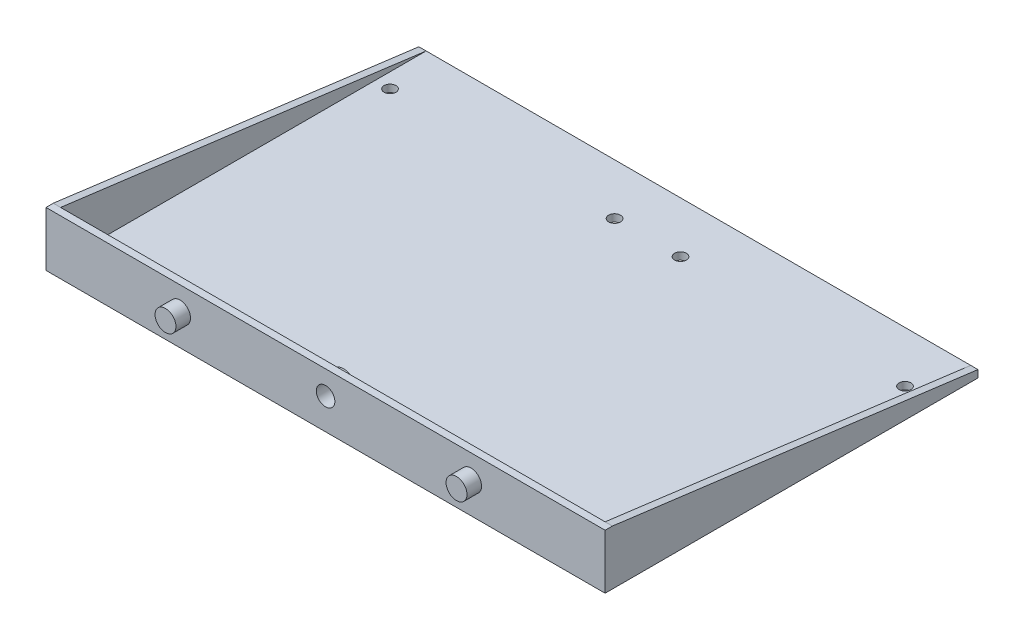
from build123d import *

# Parameters (mm, degrees)
SKETCH1_W               = 10
SKETCH1_H               = 100.5
SKETCH1_R               = 1.625
SKETCH1_W_2             = 69.85
BOSS_EXTRUDE1_DEPTH     = 2
SKETCH3_W               = 149.7
SKETCH3_H               = 2
BOSS_EXTRUDE2_DEPTH     = 2
SKETCH4_W               = 100.5
SKETCH4_H               = 2
BOSS_EXTRUDE3_DEPTH     = 2
BOSS_EXTRUDE4_DEPTH     = 2
SKETCH6_W               = 8
SKETCH6_H               = 15
BOSS_EXTRUDE5_DEPTH     = 3
CUT_EXTRUDE1_DEPTH      = 10
FILLET1_R               = 3
CUT_EXTRUDE2_DEPTH      = 10
BOSS_EXTRUDE6_START     = 3
SKETCH10_R              = 4
SKETCH10_R_2            = 2.55
BOSS_EXTRUDE6_DEPTH     = 3
SKETCH12_R              = 2.875
BOSS_EXTRUDE7_DEPTH     = 4
SKETCH13_W              = 10.946886228
SKETCH13_H              = 17.580383234
SKETCH13_W_2            = 10.296538922
SKETCH13_H_2            = 23.433508982
CUT_EXTRUDE3_DEPTH      = 43
CUT_EXTRUDE4_DEPTH      = 132
CUT_EXTRUDE4_DEPTH_BACK = 25
SKETCH15_W              = 193.54760144
SKETCH15_H              = 36.696105642


with BuildPart() as part:
    # Sketch1 → Boss-Extrude1 (new body)
    # profile 1 of 3: a face of its own
    with BuildSketch(Plane(origin=(0, 0, 0), x_dir=(1, 0, 0), z_dir=(0, 1, 0))):
        with Locations((74.85, 50.25)):
            Rectangle(SKETCH1_W, SKETCH1_H)
    # profile 2 of 3: a face of its own
    with BuildSketch(Plane(origin=(0, 0, 0), x_dir=(1, 0, 0), z_dir=(0, 1, 0))):
        Polygon((0, 0), (69.85, 0), (69.85, 100.5), (0, 100.5), (0, 86.5), align=None)
        with Locations(Location((4.07, 9.9, 0), (0, 0, 270))):
            Circle(SKETCH1_R, mode=Mode.SUBTRACT)
        with BuildLine():
            ThreePointArc((64.165, 9.9), (64.640951481, 11.049048519), (65.79, 11.525))
            ThreePointArc((65.79, 11.525), (66.939048519, 11.049048519), (67.415, 9.9))
            ThreePointArc((67.415, 9.9), (65.79, 8.275), (64.165, 9.9))
        make_face(mode=Mode.SUBTRACT)
        with BuildLine():
            ThreePointArc((5.695, 86.5), (4.07, 84.875), (2.445, 86.5))
            ThreePointArc((2.445, 86.5), (4.07, 88.125), (5.695, 86.5))
        make_face(mode=Mode.SUBTRACT)
        with BuildLine():
            ThreePointArc((65.79, 84.875), (64.640951481, 85.350951481), (64.165, 86.5))
            ThreePointArc((64.165, 86.5), (65.79, 88.125), (67.415, 86.5))
            ThreePointArc((67.415, 86.5), (66.939048519, 85.350951481), (65.79, 84.875))
        make_face(mode=Mode.SUBTRACT)
    # profile 3 of 3: a face of its own
    with BuildSketch(Plane(origin=(0, 0, 0), x_dir=(1, 0, 0), z_dir=(0, 1, 0))):
        with Locations((114.775, 50.25)):
            Rectangle(SKETCH1_W_2, SKETCH1_H)
        with Locations(Location((83.92, 9.9, 0), (0, 0, 270))):
            Circle(SKETCH1_R, mode=Mode.SUBTRACT)
        with Locations(Location((145.64, 9.9, 0), (0, 0, 270))):
            Circle(SKETCH1_R, mode=Mode.SUBTRACT)
        with Locations(Location((83.92, 86.5, 0), (0, 0, 270))):
            Circle(SKETCH1_R, mode=Mode.SUBTRACT)
        with Locations(Location((145.64, 86.5, 0), (0, 0, 270))):
            Circle(SKETCH1_R, mode=Mode.SUBTRACT)
    extrude(amount=BOSS_EXTRUDE1_DEPTH)

    # Sketch3 → Boss-Extrude2 (add)
    with BuildSketch(Plane.XY):
        Polygon((-10, 2), (-10, -13), (159.7, -13), (159.7, 2), (149.7, 2), (149.7, 0), (0, 0), (0, 2), align=None)
        with Locations((74.85, 1)):
            Rectangle(SKETCH3_W, SKETCH3_H)
    extrude(amount=BOSS_EXTRUDE2_DEPTH)

    # Sketch4 → Boss-Extrude3 (add)
    with BuildSketch(Plane.ZY):
        Polygon((0, 0), (-100.5, 0), (0, -13), align=None)
        with Locations((-50.25, 1)):
            Rectangle(SKETCH4_W, SKETCH4_H)
    extrude(amount=BOSS_EXTRUDE3_DEPTH)

    # Sketch5 → Boss-Extrude4 (add)
    with BuildSketch(Plane(origin=(149.7, 0, 0), x_dir=(0, 0, -1), z_dir=(1, 0, 0))):
        Polygon((100.5, 0), (0, -13), (0, 2), (100.5, 2), align=None)
    extrude(amount=BOSS_EXTRUDE4_DEPTH)

    # Sketch6 → Boss-Extrude5 (add)
    with BuildSketch(Plane(origin=(0, 0, 0), x_dir=(-1, 0, 0), z_dir=(0, 0, -1))):
        with Locations((6, -5.5)):
            Rectangle(SKETCH6_W, SKETCH6_H)
        with Locations((-155.7, -5.5)):
            Rectangle(SKETCH6_W, SKETCH6_H)
    extrude(amount=BOSS_EXTRUDE5_DEPTH)

    # Sketch8 → Cut-Extrude1 (cut)
    with BuildSketch(Plane(origin=(0, 0, -3), x_dir=(-1, 0, 0), z_dir=(0, 0, -1))):
        with BuildLine():
            ThreePointArc((-153.15, -5.5), (-155.7, -2.95), (-158.25, -5.5))
            Line((-158.25, -5.5), (-153.15, -5.5))
        make_face()
        with BuildLine():
            Line((-153.15, -5.5), (-158.25, -5.5))
            ThreePointArc((-158.25, -5.5), (-155.7, -8.05), (-153.15, -5.5))
        make_face()
        with BuildLine():
            ThreePointArc((3.45, -5.5), (6, -8.05), (8.55, -5.5))
            Line((8.55, -5.5), (3.45, -5.5))
        make_face()
        with BuildLine():
            Line((3.45, -5.5), (8.55, -5.5))
            ThreePointArc((8.55, -5.5), (6, -2.95), (3.45, -5.5))
        make_face()
    extrude(amount=-CUT_EXTRUDE1_DEPTH, mode=Mode.SUBTRACT)

    # Fillet1
    fillet1_edges = [part.edges().sort_by_distance(p)[0] for p in [
        (159.7, 2, -0.5),
        (-10, 2, -0.5),
        (-10, -13, -0.5),
        (159.7, -13, -0.5),
    ]]
    fillet(fillet1_edges, radius=FILLET1_R)

    # Sketch9 → Cut-Extrude2 (cut)
    with BuildSketch(Plane(origin=(0, 0, 0), x_dir=(-1, 0, 0), z_dir=(0, 0, -1))):
        with BuildLine():
            ThreePointArc((-72.3, -6.5), (-73.046877708, -4.696877708), (-74.85, -3.95))
            Line((-74.85, -3.95), (-74.85, -9.05))
            ThreePointArc((-74.85, -9.05), (-73.046877708, -8.303122292), (-72.3, -6.5))
        make_face()
        with BuildLine():
            Line((-74.85, -9.05), (-74.85, -3.95))
            ThreePointArc((-74.85, -3.95), (-77.4, -6.5), (-74.85, -9.05))
        make_face()
    extrude(amount=-CUT_EXTRUDE2_DEPTH, mode=Mode.SUBTRACT)

    # Sketch10 → Boss-Extrude6 (add)
    with BuildSketch(Plane(origin=(0, 0, 0), x_dir=(-1, 0, 0), z_dir=(0, 0, -1)).offset(BOSS_EXTRUDE6_START)):
        with Locations(Location((-74.85, -6.5, 0), (0, 0, 180))):
            Circle(SKETCH10_R)
        with Locations((-74.85, -6.5)):
            Circle(SKETCH10_R_2, mode=Mode.SUBTRACT)
    extrude(amount=-BOSS_EXTRUDE6_DEPTH)

    # Sketch12 → Boss-Extrude7 (add)
    with BuildSketch(Plane.XY.offset(2)):
        with Locations((34.85, -6.5)):
            Circle(SKETCH12_R)
        with Locations((114.85, -6.5)):
            Circle(SKETCH12_R)
    extrude(amount=BOSS_EXTRUDE7_DEPTH)

    # Sketch13 → Cut-Extrude3 (cut)
    with BuildSketch(Plane(origin=(0, 0, -3), x_dir=(-1, 0, 0), z_dir=(0, 0, -1))):
        with Locations((-157.173443114, -6.790191617)):
            Rectangle(SKETCH13_W, SKETCH13_H)
        with Locations((7.148269461, -9.716754491)):
            Rectangle(SKETCH13_W_2, SKETCH13_H_2)
    extrude(amount=-CUT_EXTRUDE3_DEPTH, mode=Mode.SUBTRACT)


with BuildPart() as body_2:
    # Mirror6: mirrored copy
    add(part.part.mirror(Plane.ZX.offset(7)))


with BuildPart() as part_1:
    add(part.part)

    # Sketch15 → Cut-Extrude4 (cut, two sides: drawn at the far end of the back side and taken through both)
    with BuildSketch(Plane(origin=(0, 0, 0), x_dir=(-1, 0, 0), z_dir=(0, 0, -1)).offset(-CUT_EXTRUDE4_DEPTH_BACK)):
        with Locations((-74.85, -10.04907563)):
            Rectangle(SKETCH15_W, SKETCH15_H)
    extrude(amount=CUT_EXTRUDE4_DEPTH + CUT_EXTRUDE4_DEPTH_BACK, mode=Mode.SUBTRACT)


solid = body_2.part
